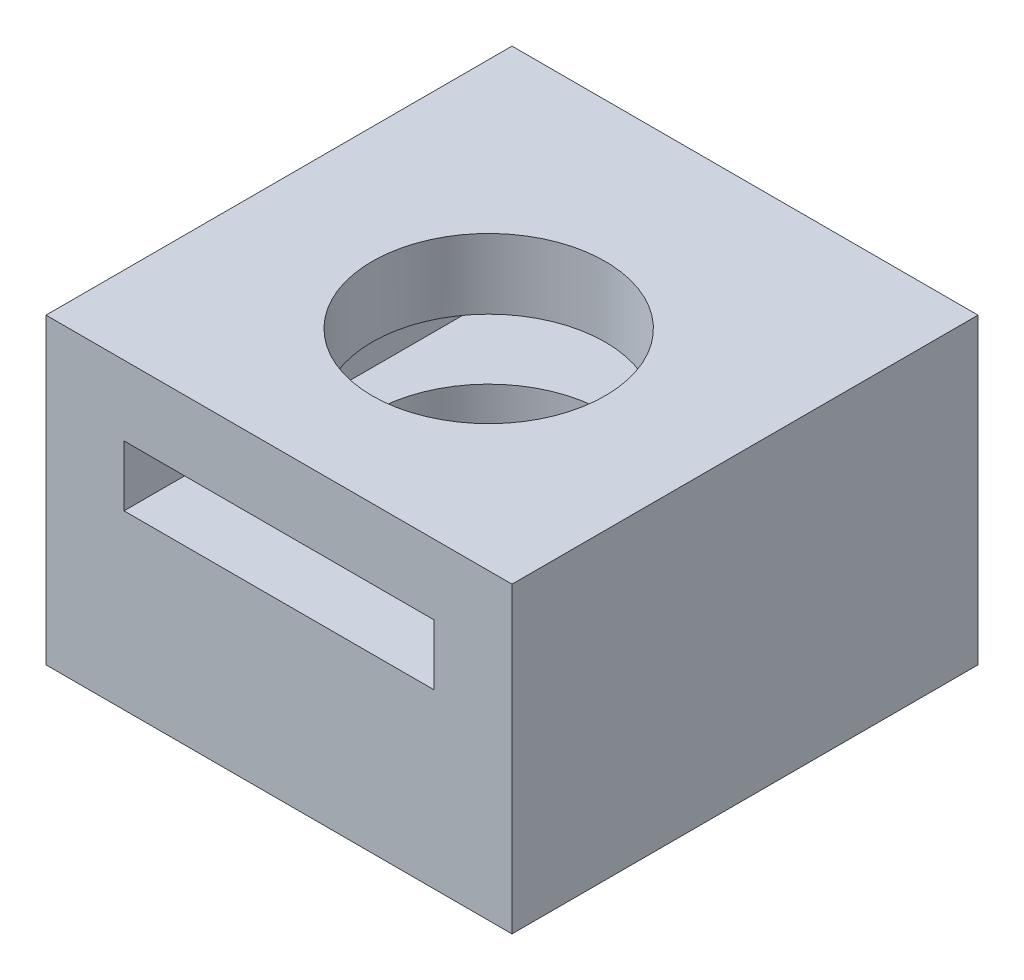
from build123d import *

# Parameters (mm, degrees)
CROQUIS1_W              = 20
CROQUIS1_H              = 20
SALIENTE_EXTRUIR1_DEPTH = 13
CROQUIS3_W              = 13.3
CROQUIS3_H              = 2.6
CORTAR_EXTRUIR1_DEPTH   = 18
CORTAR_EXTRUIR2_REACH   = 33.129
CROQUIS4_R              = 5


with BuildPart() as part:
    # Croquis1 → Saliente-Extruir1 (new body)
    with BuildSketch(Plane(origin=(0, 0, 0), x_dir=(1, 0, 0), z_dir=(0, 1, 0))):
        with Locations((-10, -10)):
            Rectangle(CROQUIS1_W, CROQUIS1_H)
    extrude(amount=SALIENTE_EXTRUIR1_DEPTH)

    # Croquis3 → Cortar-Extruir1 (cut)
    with BuildSketch(Plane.XY.offset(20)):
        with Locations((-10, 8.7)):
            Rectangle(CROQUIS3_W, CROQUIS3_H)
    extrude(amount=-CORTAR_EXTRUIR1_DEPTH, mode=Mode.SUBTRACT)

    # Cortar-Extruir2: up to this face of the body (flat: up to its plane)
    cortar_extruir2_end = Plane(part.part.faces().sort_by_distance((-10, 0, 10))[0])
    # Croquis4 → Cortar-Extruir2 (cut, up to the picked face)
    with BuildSketch(Plane(origin=(0, 13, 0), x_dir=(1, 0, 0), z_dir=(0, 1, 0)), mode=Mode.PRIVATE) as cortar_extruir2_sk1:
        with Locations(Location((-10, -11, 0), (0, 0, 90))):
            Circle(CROQUIS4_R)
    cortar_extruir2_tool1 = split(extrude(cortar_extruir2_sk1.sketch, amount=-CORTAR_EXTRUIR2_REACH, mode=Mode.PRIVATE), bisect_by=cortar_extruir2_end, keep=Keep.BOTH, mode=Mode.PRIVATE)
    add(cortar_extruir2_tool1.solids().sort_by(Axis((-10, 13, 11), (0, -1, 0)))[0], mode=Mode.SUBTRACT)


solid = part.part
